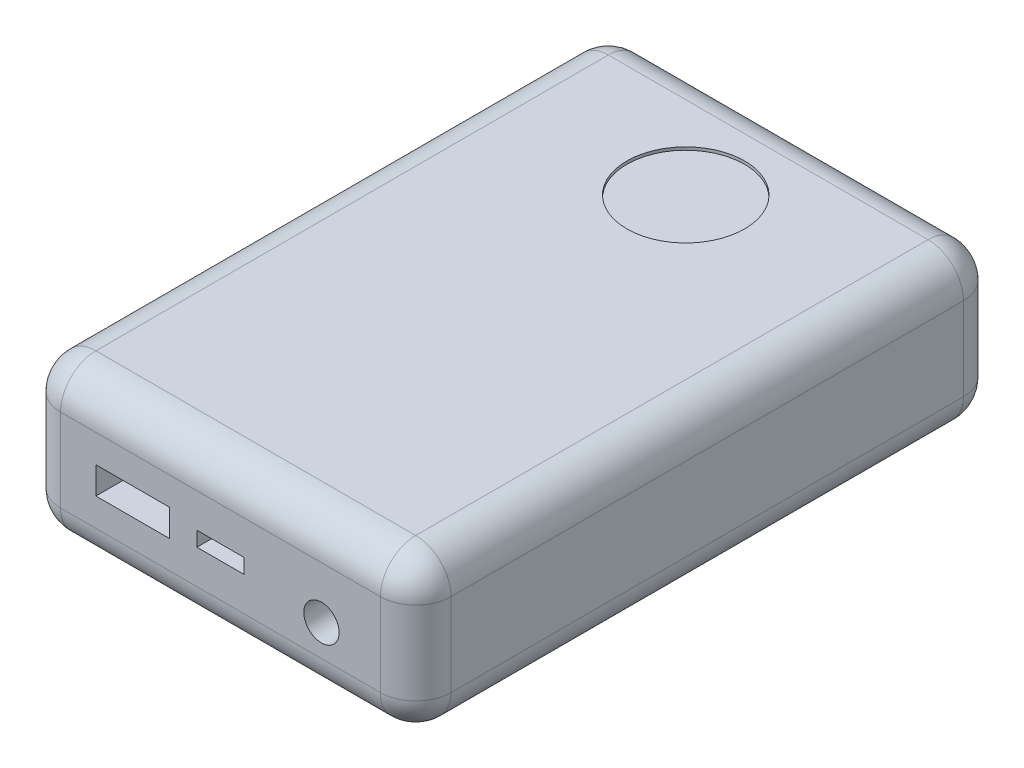
from build123d import *

# Parameters (mm, degrees)
SKETCH1_W           = 66.3
SKETCH1_H           = 26.1
BOSS_EXTRUDE1_DEPTH = 49.5
SKETCH2_R           = 3
SKETCH2_W           = 12.5
SKETCH2_H           = 4.6
SKETCH2_W_2         = 8
SKETCH2_H_2         = 2.5
CONNECTORS_DEPTH    = 13
SKETCH4_R           = 10
DISPLAY_DEPTH       = 0.5
FILLET1_R           = 6


with BuildPart() as part:
    # Sketch1 → Boss-Extrude1 (new, symmetric)
    with BuildSketch(Plane.XY):
        with Locations((0, 13.05)):
            Rectangle(SKETCH1_W, SKETCH1_H)
    extrude(amount=BOSS_EXTRUDE1_DEPTH, both=True)

    # Sketch2 → connectors (cut)
    with BuildSketch(Plane.XY.offset(49.5)):
        with Locations((17.15, 11.3)):
            Circle(SKETCH2_R)
        with Locations((-14.9, 13.05)):
            Rectangle(SKETCH2_W, SKETCH2_H)
        with Locations((0, 13.05)):
            Rectangle(SKETCH2_W_2, SKETCH2_H_2)
    extrude(amount=-CONNECTORS_DEPTH, mode=Mode.SUBTRACT)

    # Sketch4 → display (cut)
    with BuildSketch(Plane(origin=(0, 26.1, 0), x_dir=(1, 0, 0), z_dir=(0, 1, 0))):
        with Locations(Location((0, 29.5, 0), (0, 0, 270))):
            Circle(SKETCH4_R)
    extrude(amount=-DISPLAY_DEPTH, mode=Mode.SUBTRACT)

    # Fillet1
    fillet1_edges = [part.edges().sort_by_distance(p)[0] for p in [
        (33.15, 13.05, 49.5),
        (0, 26.1, 49.5),
        (-33.15, 13.05, 49.5),
        (0, 26.1, -49.5),
        (33.15, 13.05, -49.5),
        (0, 0, -49.5),
        (-33.15, 13.05, -49.5),
        (-33.15, 26.1, 0),
        (33.15, 26.1, 0),
        (33.15, 0, 0),
        (-33.15, 0, 0),
        (0, 0, 49.5),
    ]]
    fillet(fillet1_edges, radius=FILLET1_R)


solid = part.part
